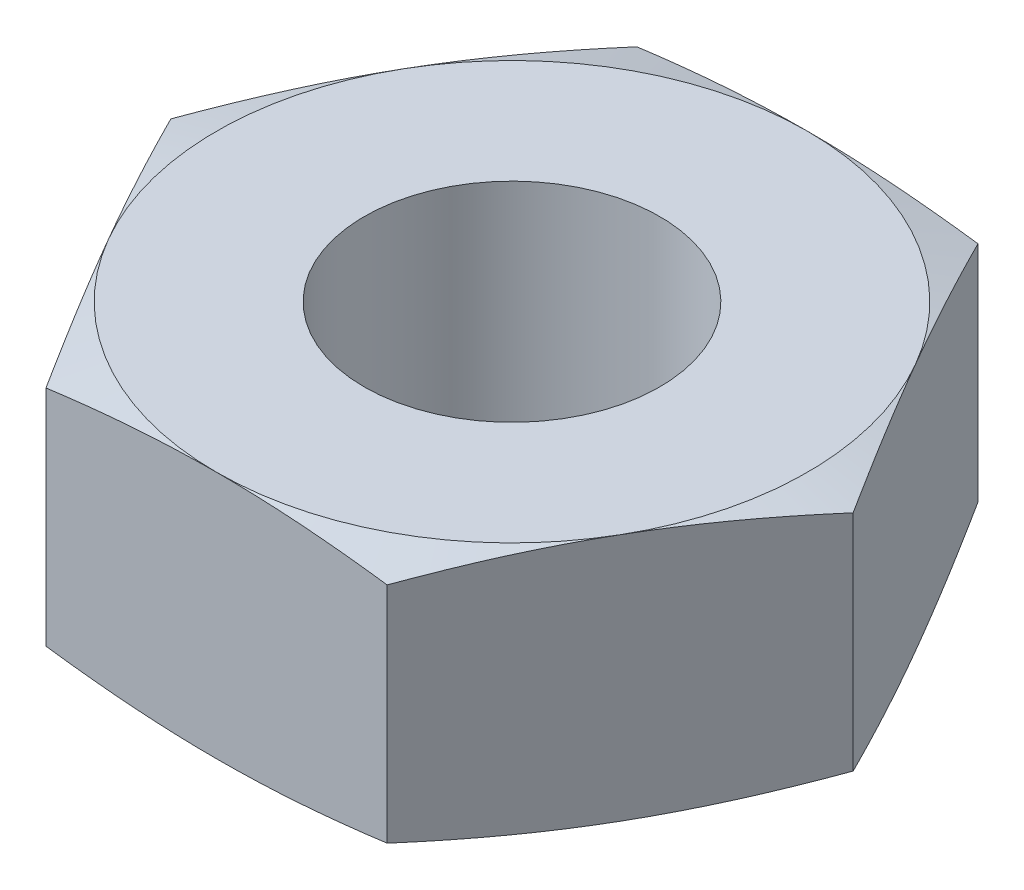
from build123d import *

# Parameters (mm, degrees)
EXTRUDE_1_DEPTH    = 2.1
HOLE_WIZARD_M3_1_D = 2.5


with BuildPart() as part:
    # 草图1 → 凸台-拉伸1 (new body)
    with BuildSketch(Plane(origin=(0, 0, 0), x_dir=(1, 0, 0), z_dir=(0, 1, 0))):
        Polygon((2.886751346, 0), (1.443375673, 2.5), (-1.443375673, 2.5), (-2.886751346, 0), (-1.443375673, -2.5), (1.443375673, -2.5), align=None)
    extrude(amount=EXTRUDE_1_DEPTH)

    # M3 螺纹孔1 (through all)
    with Locations(Plane(origin=(0, 2.1, 0), x_dir=(1, 0, 0), z_dir=(0, 1, 0))):
        with Locations((0, 0)):
            Hole(HOLE_WIZARD_M3_1_D / 2)

    # 草图5 → 切除-旋转1 (revolve, cut)
    with BuildSketch(Plane(origin=(0, 0, 0), x_dir=(0, 0, -1), z_dir=(1, 0, 0))):
        Polygon((-2.5, 0), (-4.320139506, 0.487704911), (-4.320139506, -0.855779568), align=None)
        Polygon((-4.320139506, 2.955779568), (-2.5, 2.1), (-4.320139506, 1.612295089), align=None)
    revolve(axis=Axis((0, 0, 0), (0, -1, 0)), mode=Mode.SUBTRACT)


solid = part.part
